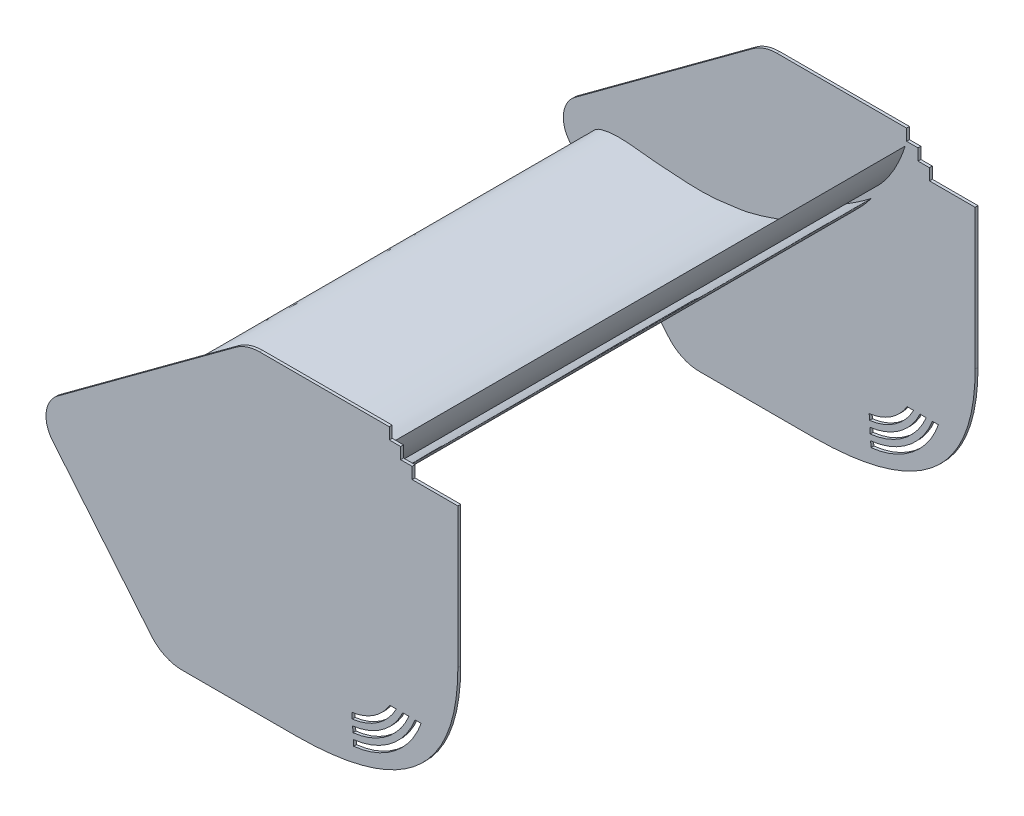
from build123d import *

# Parameters (mm, degrees)
BOSS_EXTRUDE1_DEPTH   = 900
BOSS_EXTRUDE1_2_DEPTH = 900
BOSS_EXTRUDE1_3_DEPTH = 900
BOSS_EXTRUDE2_DEPTH   = 5
CUT_EXTRUDE13_DEPTH   = 10


with BuildPart() as part:
    # Sketch2 → Boss-Extrude1 (new body)
    with BuildSketch(Plane.XY):
        with BuildLine():
            add(Edge.make_bspline(
                [(0, 0), (-0.65975565, -5.699703464), (8.017548516, -15.480562025), (19.551157506, -21.724015646), (30.016745353, -25.302215165), (39.859962541, -28.8642232), (50.040399275, -30.662933418), (60.070603806, -32.257702331), (70.013877162, -34.217674322), (80.100972933, -34.55999195), (90.093066457, -35.36519438), (100.111969814, -35.952943269), (110.128217778, -35.507216678), (120.153157744, -35.210003546), (130.150331683, -34.229800116), (140.189993261, -33.410162922), (150.178235204, -31.913406007), (160.170449627, -30.371338734), (170.240789754, -29.163640841), (180.208316099, -27.151030087), (190.263801281, -25.306120223), (200.239152099, -22.872450662), (210.244577583, -20.429111012), (220.232934245, -17.895088966), (230.381125348, -15.705438437), (240.351948949, -12.391144832), (253.551193017, -7.369638816), (266.947574476, -2.806549313), (280.436865809, 1.636643436), (290.361357742, 5.819516769), (300.440735094, 10.032227759), (310.304777653, 14.884053202), (323.821431636, 20.884190166), (337.30228202, 27.249833417), (350.274680503, 34.850235797), (364.037447664, 41.200679435), (378.073354269, 50.431878374), (389.268655411, 56.991671546), (404.933124868, 70.670428585), (388.893146181, 60.897261379), (380.961681237, 56.833339948), (370.316551331, 52.173205743), (360.413556578, 47.749137904), (350.469658047, 43.075442492), (340.496714174, 38.833200032), (330.405194537, 35.260956145), (320.349773519, 31.849438488), (310.358327921, 28.32591748), (300.486931551, 24.662169398), (290.321799777, 22.300639283), (280.290360105, 19.76188557), (270.426731207, 16.765017679), (260.335958512, 15.061341224), (250.276874186, 13.958758108), (240.266180313, 12.578254982), (230.278688892, 11.06786106), (220.28670052, 9.696364143), (210.243264635, 9.240413966), (200.228739037, 9.034505305), (190.217040672, 8.279165066), (180.212460889, 9.162360851), (170.184221628, 8.728504773), (160.186505008, 9.582197967), (150.167787888, 9.989196896), (140.163470123, 10.700746944), (130.145958281, 11.214450998), (120.121382338, 11.840881885), (110.132801048, 12.969737489), (100.114836916, 13.850136605), (90.093770057, 14.715857774), (80.079633724, 15.842660607), (56.917746978, 18.847498868), (32.382831952, 18.963380484), (8.41761673, 12.262874152), (0.546057517, 4.717452477), (0, 0)],
                knots=[0, 0, 0, 0, 0.022023736, 0.035622153, 0.048196888, 0.060584536, 0.072602109, 0.084545422, 0.096478612, 0.108283816, 0.120089627, 0.131879307, 0.143660654, 0.15544949, 0.167268546, 0.17910001, 0.190991158, 0.20289685, 0.214787999, 0.226765538, 0.23876847, 0.250863752, 0.262991876, 0.27512, 0.287234564, 0.299600692, 0.31214973, 0.337081787, 0.34954249, 0.362249466, 0.375072168, 0.388091419, 0.401030286, 0.427260863, 0.440708926, 0.453891579, 0.481343844, 0.495528159, 0.510184265, 0.522427916, 0.535732546, 0.548643086, 0.561553626, 0.574510663, 0.587286643, 0.599816472, 0.612271303, 0.624763182, 0.637218013, 0.649381244, 0.661544475, 0.673750263, 0.685718325, 0.697586388, 0.709471547, 0.721375261, 0.733243324, 0.745039761, 0.756824219, 0.768610895, 0.780397571, 0.792175284, 0.803971722, 0.815766061, 0.82756692, 0.839363385, 0.851169099, 0.863005976, 0.874833225, 0.886659586, 0.898509641, 0.910371212, 0.969295412, 0.981771696, 1, 1, 1, 1], degree=3))
        make_face()
    extrude(amount=BOSS_EXTRUDE1_DEPTH)



with BuildPart() as body_2:
    # Sketch2 → Boss-Extrude1 2 (new body)
    with BuildSketch(Plane.XY):
        with BuildLine():
            add(Edge.make_bspline(
                [(488.73992863, 146.276625829), (488.734390863, 146.282664356), (488.424255517, 146.015046997), (488.06224571, 145.78510435), (487.262468982, 145.126312202), (486.219708703, 144.371292999), (484.873478649, 143.336701677), (483.250678892, 142.116067573), (481.344943871, 140.702556836), (479.183854282, 139.108333078), (476.761259361, 137.364331889), (474.123745832, 135.449437464), (471.236790602, 133.439330858), (468.165688429, 131.291310186), (464.896239769, 129.067635846), (461.457519682, 126.769533617), (457.874048726, 124.410588123), (454.151349507, 122.026984888), (450.329646269, 119.608278587), (446.41836705, 117.19210493), (442.442349173, 114.792641259), (438.43193703, 112.415341988), (434.42114363, 110.058907294), (430.419325782, 107.74839744), (426.469079038, 105.475179612), (422.572434597, 103.270040027), (418.782946314, 101.105445668), (415.103822048, 99.01892845), (411.581105321, 96.980001912), (408.223119368, 95.024650916), (405.070149132, 93.117181313), (402.117764879, 91.312769814), (399.415735867, 89.554324386), (396.965291652, 87.893504979), (394.792388291, 86.318571947), (392.915837215, 84.829964237), (391.349809227, 83.430905822), (390.083467317, 82.150893966), (389.152598068, 80.964624913), (388.566460536, 79.872034746), (388.31048608, 78.86894122), (388.452520239, 77.947544055), (389.013376817, 77.204475769), (389.915554573, 76.684991476), (391.128157446, 76.384212118), (392.650081725, 76.254634507), (394.48507873, 76.313765499), (396.623198675, 76.579439281), (399.045948072, 77.035742523), (401.735792151, 77.720460618), (404.675674285, 78.596752435), (407.839178956, 79.704940552), (411.200777121, 81.026852514), (414.720896472, 82.590974299), (418.395557374, 84.341793332), (422.179917585, 86.309143039), (426.045683707, 88.480043342), (429.970357242, 90.828820323), (433.914957703, 93.364526939), (437.871228384, 96.040204149), (441.793376071, 98.866131635), (445.668479549, 101.797178284), (449.465692449, 104.827226536), (453.167907327, 107.924049831), (456.76145535, 111.053999458), (460.202936902, 114.219487851), (463.519091154, 117.342970547), (466.650128692, 120.455005022), (469.613566921, 123.489837804), (472.370170636, 126.450937081), (474.953957291, 129.265647603), (477.297780382, 131.960513478), (479.456204478, 134.463515761), (481.381106749, 136.784579704), (483.077897662, 138.897364919), (484.557730654, 140.769579134), (485.809879979, 142.38248786), (486.847928071, 143.738913606), (487.625844434, 144.768628828), (488.251100258, 145.595659419), (488.480713959, 145.957078055), (488.74539046, 146.270670107), (488.73992863, 146.276625829)],
                knots=[0, 0, 0, 0, 0.000781199, 0.003073574, 0.006930933, 0.012248071, 0.019030102, 0.027225991, 0.036784991, 0.047610037, 0.059602429, 0.072763906, 0.086896902, 0.102003859, 0.117938515, 0.134556032, 0.151857595, 0.169650659, 0.187837924, 0.206373783, 0.225065344, 0.243814112, 0.262569213, 0.281136751, 0.299513586, 0.317505655, 0.335105223, 0.352118009, 0.368487898, 0.384166869, 0.39895523, 0.412906354, 0.425871787, 0.437810597, 0.448585292, 0.458212857, 0.466668993, 0.473884465, 0.479894259, 0.484778924, 0.488742849, 0.492166792, 0.495627983, 0.499576303, 0.504486665, 0.51057614, 0.517942731, 0.526573967, 0.536524046, 0.547640111, 0.560015283, 0.573490911, 0.58803144, 0.603543533, 0.619911609, 0.637089411, 0.654944026, 0.673346428, 0.692212491, 0.711460838, 0.730910148, 0.750475101, 0.77002178, 0.789460649, 0.808651173, 0.827457923, 0.845819698, 0.863558965, 0.880665567, 0.896944906, 0.912322084, 0.926717772, 0.939992516, 0.952161421, 0.963060032, 0.972661788, 0.980906352, 0.987732879, 0.993080076, 0.996902186, 0.999229514, 1, 1, 1, 1], degree=3))
        make_face()
    extrude(amount=BOSS_EXTRUDE1_2_DEPTH)


with BuildPart() as body_3:
    # Sketch2 → Boss-Extrude1 3 (new body)
    with BuildSketch(Plane.XY):
        with BuildLine():
            add(Edge.make_bspline(
                [(548.142677429, 255.362022493), (548.135374227, 255.365952606), (547.927936153, 255.006923964), (547.658371583, 254.666651265), (547.113002911, 253.770748213), (546.367364831, 252.702005657), (545.424638558, 251.265023805), (544.27941979, 249.558165284), (542.927897021, 247.572779047), (541.392389605, 245.329670238), (539.656724271, 242.856366084), (537.77246287, 240.148181213), (535.681420522, 237.265978202), (533.460225952, 234.1906606), (531.074588655, 230.97702341), (528.551895931, 227.635912658), (525.911068883, 224.188473742), (523.145346923, 220.671136821), (520.29665909, 217.087300279), (517.361495783, 213.476080086), (514.358883712, 209.859293663), (511.316016626, 206.252251869), (508.265842752, 202.665029322), (505.208968651, 199.124696426), (502.1889872, 195.637173296), (499.197596623, 192.232566763), (496.295154414, 188.902374923), (493.472239146, 185.683544867), (490.783011296, 182.562252326), (488.223454385, 179.575667492), (485.843956575, 176.703071592), (483.621924068, 173.995738505), (481.623931594, 171.41564926), (479.833965661, 169.012598811), (478.280745879, 166.784000715), (476.982109533, 164.736533764), (475.9505309, 162.877995089), (475.165835333, 161.232977644), (474.670653437, 159.789198906), (474.473857946, 158.549678558), (474.562913108, 157.505571006), (475.005273255, 156.671993733), (475.788683212, 156.148250847), (476.823995566, 155.951818146), (478.083297743, 156.067751239), (479.581340455, 156.450270824), (481.315884792, 157.117361276), (483.27148496, 158.082761094), (485.435756441, 159.325104089), (487.779363945, 160.874677932), (490.298259918, 162.690587977), (492.953775055, 164.80259248), (495.727550679, 167.184824621), (498.572278285, 169.851349424), (501.502624239, 172.747773867), (504.46579375, 175.887697633), (507.439057803, 179.249297912), (510.409450838, 182.800544998), (513.336696107, 186.537123271), (516.228525151, 190.411393589), (519.037740226, 194.417946242), (521.767005491, 198.509337516), (524.388867963, 202.669455575), (526.897696092, 206.861800297), (529.291618766, 211.049656155), (531.528344155, 215.220888935), (533.659235885, 219.310264722), (535.616969063, 223.327101968), (537.440168258, 227.214370322), (539.090171449, 230.962330487), (540.623673351, 234.512844247), (541.967651222, 237.868945421), (543.198230675, 240.979940777), (544.266104832, 243.839306635), (545.18521028, 246.423662369), (545.97695415, 248.705848341), (546.637316417, 250.664385968), (547.178342468, 252.306492823), (547.579395063, 253.549717004), (547.901947032, 254.548383811), (548.001197383, 254.970292394), (548.149880485, 255.358146272), (548.142677429, 255.362022493)],
                knots=[0, 0, 0, 0, 0.000781199, 0.003073574, 0.006930933, 0.012248071, 0.019030102, 0.027225991, 0.036784991, 0.047610037, 0.059602429, 0.072763906, 0.086896902, 0.102003859, 0.117938515, 0.134556032, 0.151857595, 0.169650659, 0.187837924, 0.206373783, 0.225065344, 0.243814112, 0.262569213, 0.281136751, 0.299513586, 0.317505655, 0.335105223, 0.352118009, 0.368487898, 0.384166869, 0.39895523, 0.412906354, 0.425871787, 0.437810597, 0.448585292, 0.458212857, 0.466668993, 0.473884465, 0.479894259, 0.484778924, 0.488742849, 0.492166792, 0.495627983, 0.499576303, 0.504486665, 0.51057614, 0.517942731, 0.526573967, 0.536524046, 0.547640111, 0.560015283, 0.573490911, 0.58803144, 0.603543533, 0.619911609, 0.637089411, 0.654944026, 0.673346428, 0.692212491, 0.711460838, 0.730910148, 0.750475101, 0.77002178, 0.789460649, 0.808651173, 0.827457923, 0.845819698, 0.863558965, 0.880665567, 0.896944906, 0.912322084, 0.926717772, 0.939992516, 0.952161421, 0.963060032, 0.972661788, 0.980906352, 0.987732879, 0.993080076, 0.996902186, 0.999229514, 1, 1, 1, 1], degree=3))
        make_face()
    extrude(amount=BOSS_EXTRUDE1_3_DEPTH)


with BuildPart() as part_1:
    add(part.part)

    add(body_2.part)  # Boss-Extrude2 merges body 2

    add(body_3.part)  # Boss-Extrude2 merges body 3
    # Sketch3 → Boss-Extrude2 (add)
    with BuildSketch(Plane.XY.offset(900)):
        with BuildLine():
            Line((458.957063596, 283.843126695), (550.529187082, 283.843126695))
            Line((550.529187082, 283.843126695), (550.529187082, 263.843126695))
            Line((550.529187082, 263.843126695), (570.529187082, 263.843126695))
            Line((570.529187082, 263.843126695), (570.529187082, 243.843126695))
            Line((570.529187082, 243.843126695), (590.529187082, 243.843126695))
            Line((590.529187082, 243.843126695), (590.529187082, 223.843126695))
            Line((590.529187082, 223.843126695), (670.529187082, 223.843126695))
            Line((670.529187082, 223.843126695), (670.529187082, -21.156873305))
            add(Edge.make_bspline(
                [(670.529187082, -21.156873305), (670.529187082, -264.59888521), (389.135453492, -266.156873305)],
                knots=[0, 0, 0, 1, 1, 1], degree=2))
            Line((389.135453492, -266.156873305), (188.134827555, -266.156873305))
            ThreePointArc((188.134827555, -266.156873305), (158.321547538, -259.490658401), (134.18660271, -240.761682867))
            Line((134.18660271, -240.761682867), (-38.534446318, -31.860578259))
            ThreePointArc((-38.534446318, -31.860578259), (-49.626215127, 6.102357917), (-29.667618261, 40.247141845))
            Line((-29.667618261, 40.247141845), (282.27207107, 270.189125279))
            ThreePointArc((282.27207107, 270.189125279), (301.946040178, 280.342073683), (323.806736635, 283.843126695))
            Line((323.806736635, 283.843126695), (458.957063596, 283.843126695))
        make_face()
    boss_extrude2 = extrude(amount=BOSS_EXTRUDE2_DEPTH)

    # Sketch11 → Cut-Extrude13 (cut)
    with BuildSketch(Plane(origin=(0, 0, 900), x_dir=(-1, 0, 0), z_dir=(0, 0, -1))):
        with BuildLine():
            Line((-488.314426509, -231.424980544), (-487.67663461, -221.435457924))
            ThreePointArc((-487.67663461, -221.435457924), (-553.448918455, -194.815614306), (-595.635587807, -137.763933127))
            Line((-595.635587807, -137.763933127), (-606.274513032, -137.763933127))
            ThreePointArc((-606.274513032, -137.763933127), (-560.875684181, -201.699125971), (-488.314426509, -231.424980544))
        make_face()
        with BuildLine():
            Line((-485.762508903, -191.455142909), (-485.124078782, -181.455624032))
            ThreePointArc((-485.124078782, -181.455624032), (-523.296625844, -167.241242189), (-551.408549486, -137.763933127))
            Line((-551.408549486, -137.763933127), (-562.839051467, -137.763933127))
            ThreePointArc((-562.839051467, -137.763933127), (-530.939942251, -174.140402747), (-485.762508903, -191.455142909))
        make_face()
        with BuildLine():
            Line((-487.038738463, -211.444302497), (-486.400709757, -201.451070855))
            ThreePointArc((-486.400709757, -201.451070855), (-538.495388367, -181.03632531), (-573.965339733, -137.763933127))
            Line((-573.965339733, -137.763933127), (-584.878494114, -137.763933127))
            ThreePointArc((-584.878494114, -137.763933127), (-545.992526798, -187.928092174), (-487.038738463, -211.444302497))
        make_face()
    cut_extrude13 = extrude(amount=-CUT_EXTRUDE13_DEPTH, mode=Mode.SUBTRACT)

    # Mirror2: Boss-Extrude2, Cut-Extrude13 across plane
    add(boss_extrude2.mirror(Plane.XY.offset(450)))
    add(cut_extrude13.mirror(Plane.XY.offset(450)), mode=Mode.SUBTRACT)


solid = part_1.part
